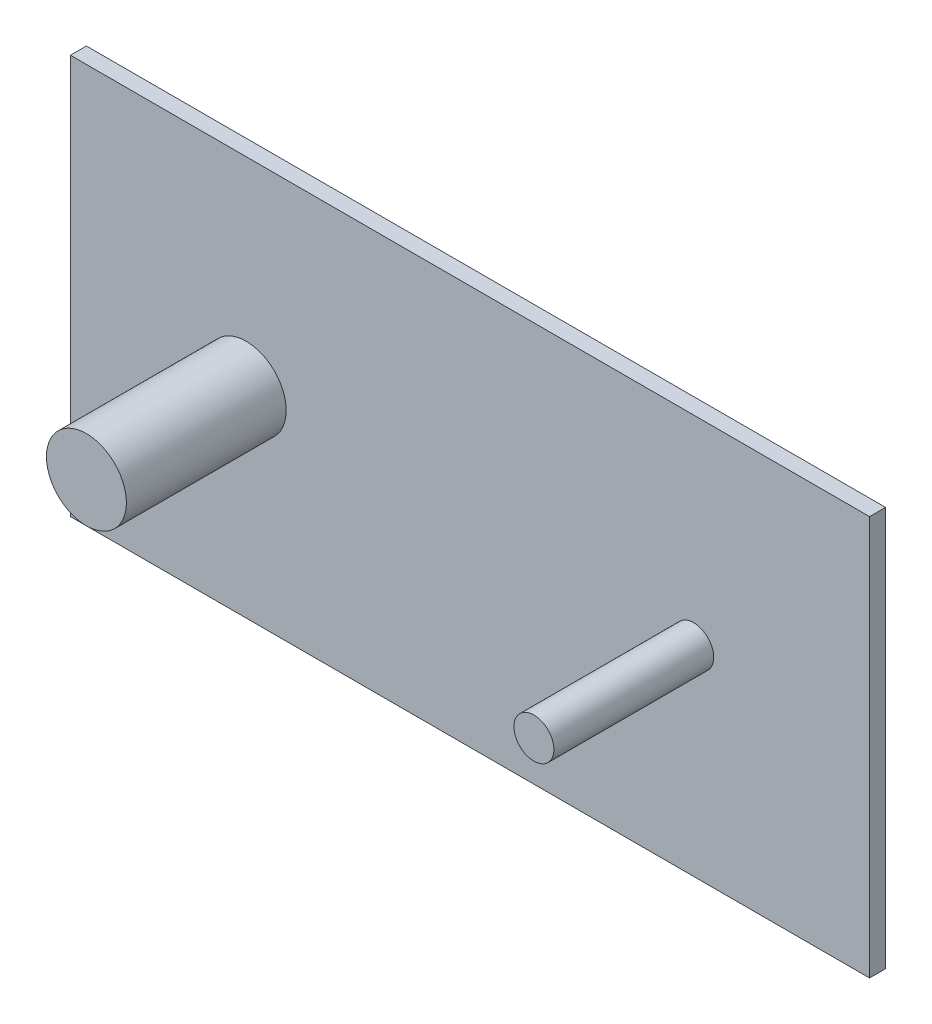
from build123d import *

# Parameters (mm, degrees)
SKETCH1_W           = 500
SKETCH1_H           = 250
BOSS_EXTRUDE1_DEPTH = 10
SKETCH2_R           = 25
SKETCH2_R_2         = 12.5
BOSS_EXTRUDE2_DEPTH = 100


with BuildPart() as part:
    # Sketch1 → Boss-Extrude1 (new body)
    with BuildSketch(Plane.XY):
        Rectangle(SKETCH1_W, SKETCH1_H)
    extrude(amount=BOSS_EXTRUDE1_DEPTH)

    # Sketch2 → Boss-Extrude2 (add)
    with BuildSketch(Plane.XY.offset(10)):
        with Locations(Location((-140, 0, 0), (0, 0, 180))):
            Circle(SKETCH2_R)
        with Locations(Location((140, 0, 0), (0, 0, 180))):
            Circle(SKETCH2_R_2)
    extrude(amount=BOSS_EXTRUDE2_DEPTH)


solid = part.part
